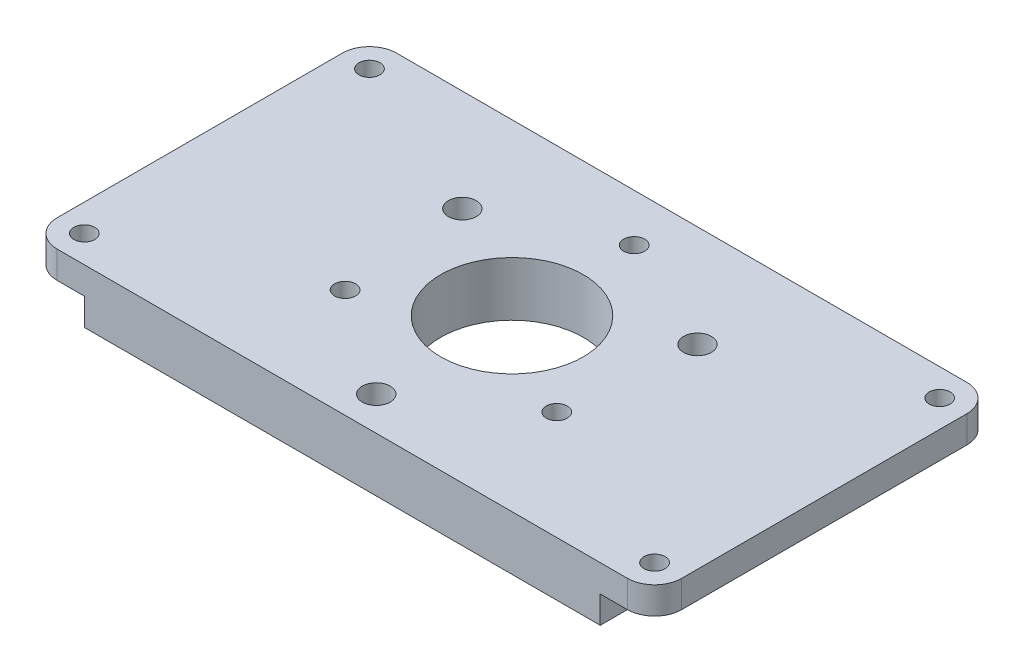
from build123d import *

# Parameters (mm, degrees)
SKETCH_1_W          = 92
SKETCH_1_H          = 50
SKETCH_1_R          = 1.55
SKETCH_1_R_2        = 10.5
SKETCH_1_R_3        = 2.05
EXTRUDE_1_DEPTH     = 4
SKETCH_13_W         = 8
SKETCH_13_H         = 50
CUT_EXTRUDE_8_DEPTH = 4
FILLET2_R           = 4
SKETCH1_R           = 6
CUT_EXTRUDE1_DEPTH  = 5


with BuildPart() as part:
    # 草图1 → 凸台-拉伸1 (new, symmetric)
    with BuildSketch(Plane(origin=(0, 0, 0), x_dir=(1, 0, 0), z_dir=(0, 1, 0))):
        Rectangle(SKETCH_1_W, SKETCH_1_H)
        with Locations(Location((-42, -21, 0), (0, 0, 270))):
            Circle(SKETCH_1_R, mode=Mode.SUBTRACT)
        with Locations(Location((0, 0, 0), (0, 0, 270))):
            Circle(SKETCH_1_R_2, mode=Mode.SUBTRACT)
        with Locations(Location((0, -20, 0), (0, 0, 270))):
            Circle(SKETCH_1_R_3, mode=Mode.SUBTRACT)
        with Locations(Location((-17.320508076, 10, 0), (0, 0, 270))):
            Circle(SKETCH_1_R_3, mode=Mode.SUBTRACT)
        with Locations(Location((17.320508076, 10, 0), (0, 0, 270))):
            Circle(SKETCH_1_R_3, mode=Mode.SUBTRACT)
        with Locations(Location((42, -21, 0), (0, 0, 90))):
            Circle(SKETCH_1_R, mode=Mode.SUBTRACT)
        with Locations(Location((42, 21, 0), (0, 0, 270))):
            Circle(SKETCH_1_R, mode=Mode.SUBTRACT)
        with Locations(Location((-42, 21, 0), (0, 0, 90))):
            Circle(SKETCH_1_R, mode=Mode.SUBTRACT)
        with Locations(Location((0, 18, 0), (0, 0, 270))):
            Circle(SKETCH_1_R, mode=Mode.SUBTRACT)
        with Locations(Location((15.588457268, -9, 0), (0, 0, 270))):
            Circle(SKETCH_1_R, mode=Mode.SUBTRACT)
        with Locations(Location((-15.588457268, -9, 0), (0, 0, 270))):
            Circle(SKETCH_1_R, mode=Mode.SUBTRACT)
    extrude(amount=EXTRUDE_1_DEPTH, both=True)

    # 草图13 → 切除-拉伸8 (cut)
    with BuildSketch(Plane.XZ.offset(4)):
        with Locations((42, 0)):
            Rectangle(SKETCH_13_W, SKETCH_13_H)
        with Locations((-42, 0)):
            Rectangle(SKETCH_13_W, SKETCH_13_H)
    extrude(amount=-CUT_EXTRUDE_8_DEPTH, mode=Mode.SUBTRACT)

    # Fillet2
    fillet2_edges = [part.edges().sort_by_distance(p)[0] for p in [
        (46, 2, -25),
        (46, 2, 25),
        (-46, 2, -25),
        (-46, 2, 25),
    ]]
    fillet(fillet2_edges, radius=FILLET2_R)

    # Sketch1 → Cut-Extrude1 (cut)
    with BuildSketch(Plane(origin=(0, -4, 0), x_dir=(-1, 0, 0), z_dir=(0, -1, 0))):
        with Locations(Location((0, 18, 0), (0, 0, 90))):
            Circle(SKETCH1_R)
        with Locations(Location((15.588457268, -9, 0), (0, 0, 90))):
            Circle(SKETCH1_R)
        with Locations(Location((-15.588457268, -9, 0), (0, 0, 90))):
            Circle(SKETCH1_R)
    extrude(amount=-CUT_EXTRUDE1_DEPTH, mode=Mode.SUBTRACT)


solid = part.part
